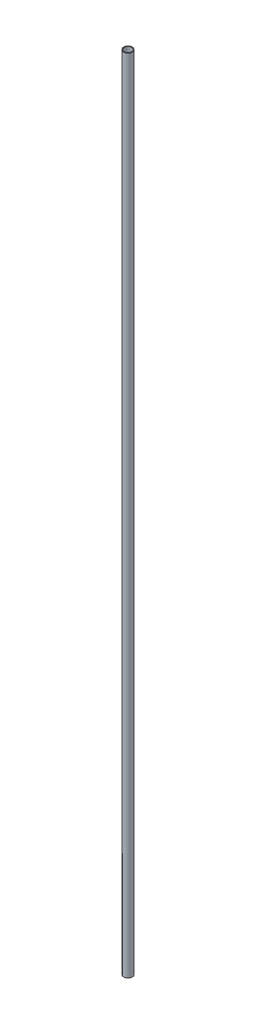
from build123d import *

# Parameters (mm, degrees)
SKETCH1_R           = 17.4625
SKETCH1_R_2         = 14.9225
BOSS_EXTRUDE1_DEPTH = 3200.4


with BuildPart() as part:
    # Sketch1 → Boss-Extrude1 (new body)
    with BuildSketch(Plane(origin=(-248.289636567, -730.285727893, -323.291439468), x_dir=(-0.03327691744130539, 0, -0.9994461700189784), z_dir=(0, 1, 0))):
        with Locations(Location((96.806797282, 114.344210709, 0), (0, 0, 178.093021015))):
            Circle(SKETCH1_R)
        with Locations(Location((96.806797282, 114.344210709, 0), (0, 0, 178.093021015))):
            Circle(SKETCH1_R_2, mode=Mode.SUBTRACT)
    extrude(amount=BOSS_EXTRUDE1_DEPTH)


solid = part.part
